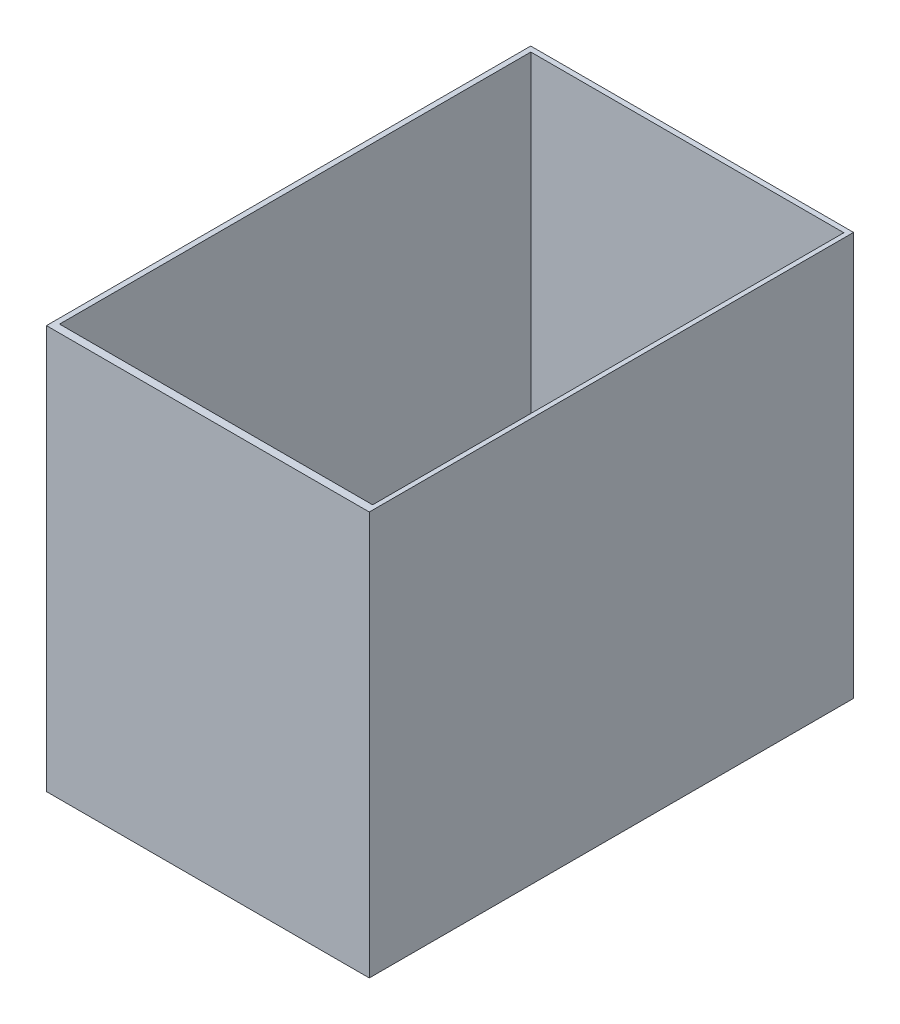
from build123d import *

# Parameters (mm, degrees)
SKETCH1_W           = 800
SKETCH1_H           = 1200
BOSS_EXTRUDE1_DEPTH = 1000
SKETCH2_W           = 775.691069095
SKETCH2_H           = 1167.725000343
CUT_EXTRUDE1_DEPTH  = 900


with BuildPart() as part:
    # Sketch1 → Boss-Extrude1 (new body)
    with BuildSketch(Plane(origin=(0, 0, 0), x_dir=(1, 0, 0), z_dir=(0, 1, 0))):
        with Locations((57.795275591, -406.94488189)):
            Rectangle(SKETCH1_W, SKETCH1_H)
    extrude(amount=BOSS_EXTRUDE1_DEPTH)

    # Sketch2 → Cut-Extrude1 (cut)
    with BuildSketch(Plane(origin=(0, 1000, 0), x_dir=(1, 0, 0), z_dir=(0, 1, 0))):
        with Locations((58.656939549, -403.594164529)):
            Rectangle(SKETCH2_W, SKETCH2_H)
    extrude(amount=-CUT_EXTRUDE1_DEPTH, mode=Mode.SUBTRACT)


solid = part.part
